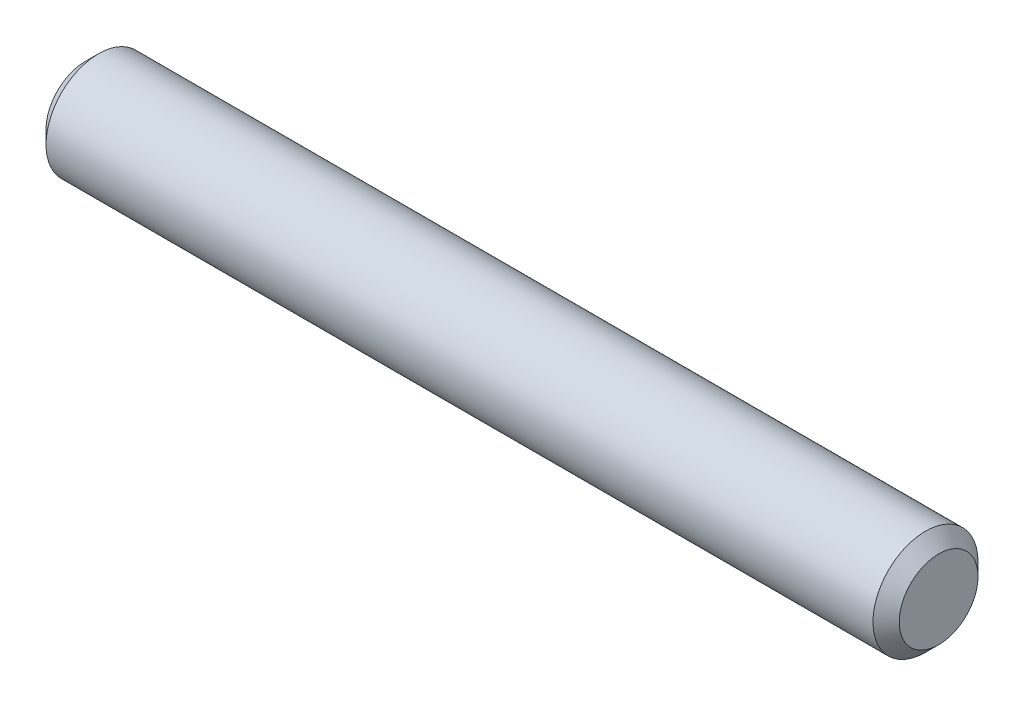
from build123d import *

# Parameters (mm, degrees)
SKETCH1_R           = 4
BOSS_EXTRUDE1_DEPTH = 65
CHAMFER1_SIZE       = 1


with BuildPart() as part:
    # Sketch1 → Boss-Extrude1 (new body)
    with BuildSketch(Plane(origin=(0, 0, 0), x_dir=(0, 0, -1), z_dir=(1, 0, 0))):
        with Locations((0, 0.376369311)):
            Circle(SKETCH1_R)
    extrude(amount=BOSS_EXTRUDE1_DEPTH)

    # Chamfer1
    chamfer1_edges = [part.edges().sort_by_distance(p)[0] for p in [
        (0, 0.376369311, 4),
        (65, 0.376369311, 4),
    ]]
    chamfer(chamfer1_edges, length=CHAMFER1_SIZE)


solid = part.part
